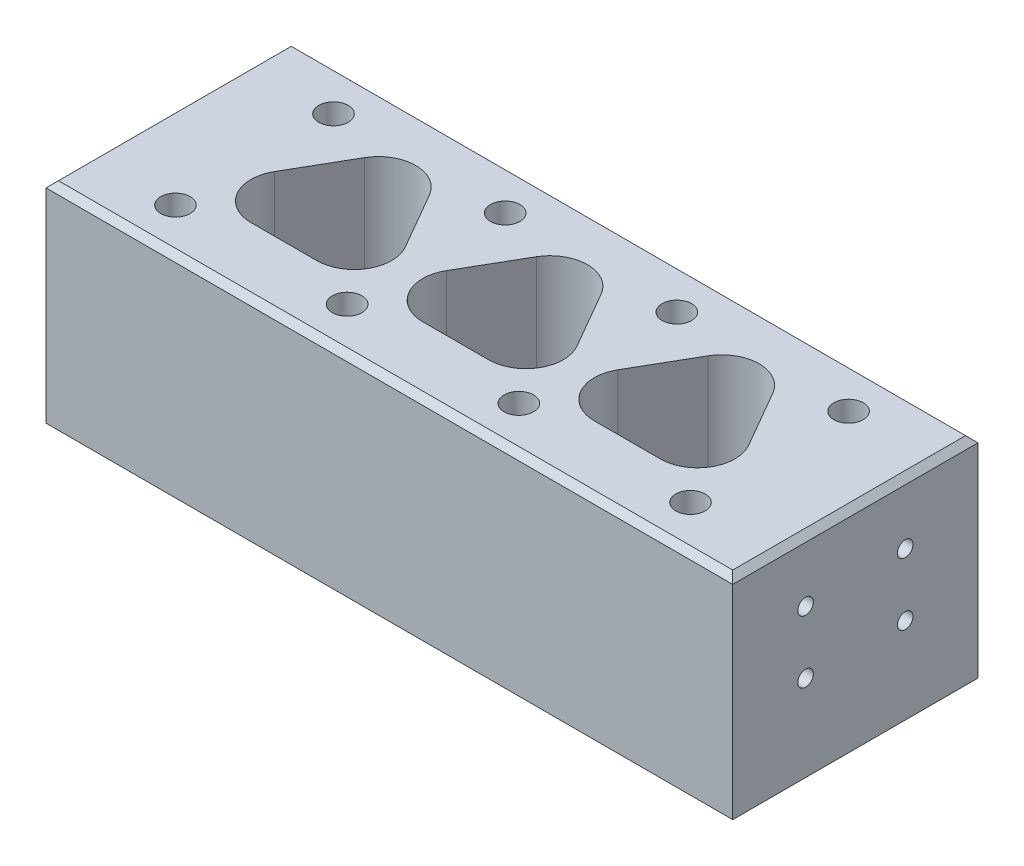
from build123d import *

# Parameters (mm, degrees)
SKETCH3_W            = 140
SKETCH3_H            = 42.809999978
BOSS_EXTRUDE1_DEPTH  = 50
SKETCH4_R            = 9
CUT_EXTRUDE1_DEPTH   = 50
LPATTERN1_COUNT      = 2
LPATTERN1_PITCH      = 35
LPATTERN1_COL_COUNT  = 2
LPATTERN1_COL_PITCH  = 35
CUT_EXTRUDE2_DEPTH   = 25
LPATTERN2_COUNT      = 2
LPATTERN2_PITCH      = 35
LPATTERN2_COL_COUNT  = 2
LPATTERN2_COL_PITCH  = 35
SKETCH16_R           = 3
CUT_EXTRUDE3_DEPTH   = 90.932
LPATTERN4_COUNT      = 4
LPATTERN4_PITCH      = 35
LPATTERN4_COUNT_DIR2 = 2
LPATTERN4_PITCH_DIR2 = 32.2199
BOSS_EXTRUDE2_START  = -9
SKETCH18_R           = 9
SKETCH18_R_2         = 6.985
BOSS_EXTRUDE2_DEPTH  = 9
CHAMFER1_SIZE        = 1.27
SKETCH21_R           = 1.5875
CUT_EXTRUDE6_DEPTH   = 14
SKETCH22_R           = 1.5875
CUT_EXTRUDE7_DEPTH   = 14


with BuildPart() as part:
    # Sketch3 → Boss-Extrude1 (new body)
    with BuildSketch(Plane.XY):
        Rectangle(SKETCH3_W, SKETCH3_H)
    extrude(amount=BOSS_EXTRUDE1_DEPTH)

    # Sketch4 → Cut-Extrude1 (cut)
    with BuildSketch(Plane(origin=(0, 21.404999989, 0), x_dir=(1, 0, 0), z_dir=(0, 1, 0))):
        with Locations((0, -25)):
            Circle(SKETCH4_R)
    cut_extrude1 = extrude(amount=-CUT_EXTRUDE1_DEPTH, mode=Mode.SUBTRACT)

    # LPattern1: Cut-Extrude1 ×2
    with Locations(*[(i * LPATTERN1_PITCH, 0, 0) for i in range(1, LPATTERN1_COUNT)]):
        add(cut_extrude1, mode=Mode.SUBTRACT)

    # LPattern1 col: Cut-Extrude1 ×2
    with Locations(*[(-i * LPATTERN1_COL_PITCH, 0, 0) for i in range(1, LPATTERN1_COL_COUNT)]):
        add(cut_extrude1, mode=Mode.SUBTRACT)

    # Sketch5 → Cut-Extrude2 (cut)
    with BuildSketch(Plane(origin=(0, 21.404999989, 0), x_dir=(1, 0, 0), z_dir=(0, 1, 0))):
        with BuildLine():
            Line((-6.599113577, -13.43), (-13.31947071, -25.07))
            ThreePointArc((-13.31947071, -25.07), (-13.31947071, -32.69), (-6.720357133, -36.5))
            Line((-6.720357133, -36.5), (6.720357133, -36.5))
            ThreePointArc((6.720357133, -36.5), (13.31947071, -32.69), (13.31947071, -25.07))
            Line((13.31947071, -25.07), (6.599113577, -13.43))
            ThreePointArc((6.599113577, -13.43), (0, -9.62), (-6.599113577, -13.43))
        make_face()
    cut_extrude2 = extrude(amount=-CUT_EXTRUDE2_DEPTH, mode=Mode.SUBTRACT)

    # LPattern2: Cut-Extrude2 ×2
    with Locations(*[(i * LPATTERN2_PITCH, 0, 0) for i in range(1, LPATTERN2_COUNT)]):
        add(cut_extrude2, mode=Mode.SUBTRACT)

    # LPattern2 col: Cut-Extrude2 ×2
    with Locations(*[(-i * LPATTERN2_COL_PITCH, 0, 0) for i in range(1, LPATTERN2_COL_COUNT)]):
        add(cut_extrude2, mode=Mode.SUBTRACT)

    # Sketch16 → Cut-Extrude3 (cut)
    with BuildSketch(Plane(origin=(0, 21.404999989, 0), x_dir=(1, 0, 0), z_dir=(0, 1, 0))):
        with Locations((-52.5, -8.89)):
            Circle(SKETCH16_R)
    cut_extrude3 = extrude(amount=-CUT_EXTRUDE3_DEPTH, mode=Mode.SUBTRACT)

    # LPattern4: Cut-Extrude3 4 × 2
    with Locations(*[(i * LPATTERN4_PITCH, 0, j * LPATTERN4_PITCH_DIR2) for i in range(LPATTERN4_COUNT) for j in range(LPATTERN4_COUNT_DIR2) if (i, j) != (0, 0)]):
        add(cut_extrude3, mode=Mode.SUBTRACT)

    # Sketch18 → Boss-Extrude2 (add)
    # profile 1 of 3: a face of its own
    with BuildSketch(Plane.XZ.offset(21.404999989).offset(BOSS_EXTRUDE2_START)):
        with Locations((0, 25)):
            Circle(SKETCH18_R)
        with Locations((0, 25)):
            Circle(SKETCH18_R_2, mode=Mode.SUBTRACT)
    # profile 2 of 3: a face of its own
    with BuildSketch(Plane.XZ.offset(21.404999989).offset(BOSS_EXTRUDE2_START)):
        with Locations((-35, 25)):
            Circle(SKETCH18_R)
        with Locations((-35, 25)):
            Circle(SKETCH18_R_2, mode=Mode.SUBTRACT)
    # profile 3 of 3: a face of its own
    with BuildSketch(Plane.XZ.offset(21.404999989).offset(BOSS_EXTRUDE2_START)):
        with Locations((35, 25)):
            Circle(SKETCH18_R)
        with Locations((35, 25)):
            Circle(SKETCH18_R_2, mode=Mode.SUBTRACT)
    extrude(amount=BOSS_EXTRUDE2_DEPTH)

    # Chamfer1
    chamfer1_edges = [part.edges().sort_by_distance(p)[0] for p in [
        (-70, 21.404999989, 25),
        (0, 21.404999989, 0),
        (70, 21.404999989, 25),
        (0, 21.404999989, 50),
    ]]
    chamfer(chamfer1_edges, length=CHAMFER1_SIZE)

    # Sketch21 → Cut-Extrude6 (cut)
    with BuildSketch(Plane(origin=(70, 0, 0), x_dir=(0, 0, -1), z_dir=(1, 0, 0))):
        with Locations((-35.16, 8.855000011)):
            Circle(SKETCH21_R)
        with Locations((-35.16, -3.844999989)):
            Circle(SKETCH21_R)
        with Locations((-14.84, -3.844999989)):
            Circle(SKETCH21_R)
        with Locations((-14.84, 8.855000011)):
            Circle(SKETCH21_R)
    extrude(amount=-CUT_EXTRUDE6_DEPTH, mode=Mode.SUBTRACT)

    # Sketch22 → Cut-Extrude7 (cut)
    with BuildSketch(Plane.ZY.offset(70)):
        with Locations((14.84, 8.821000011)):
            Circle(SKETCH22_R)
        with Locations((14.84, -3.878999989)):
            Circle(SKETCH22_R)
        with Locations((35.16, 8.821000011)):
            Circle(SKETCH22_R)
        with Locations((35.16, -3.878999989)):
            Circle(SKETCH22_R)
    extrude(amount=-CUT_EXTRUDE7_DEPTH, mode=Mode.SUBTRACT)


solid = part.part
